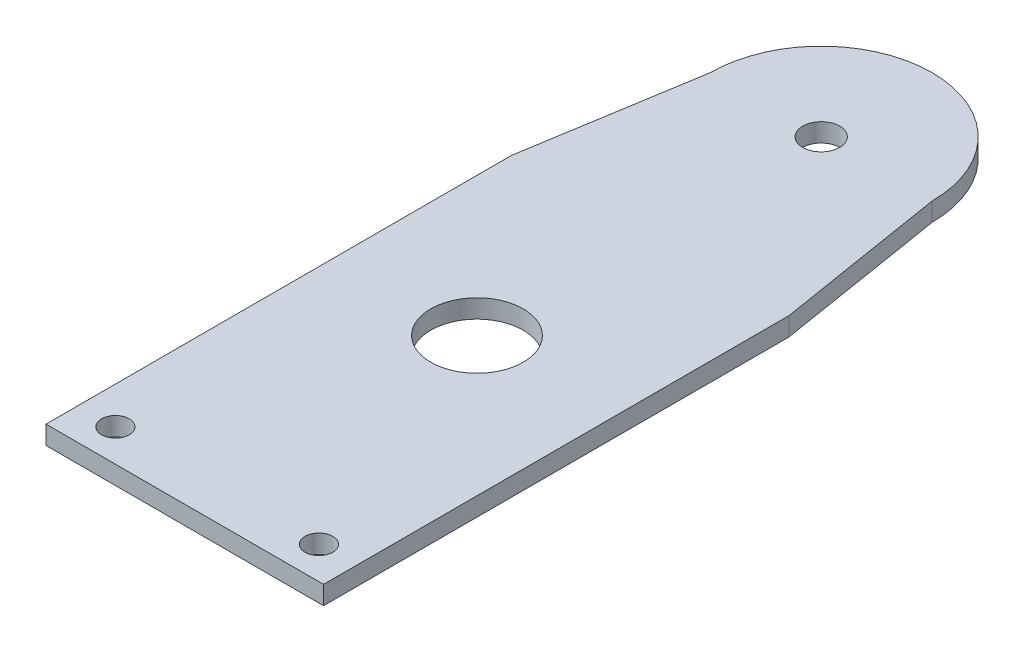
from build123d import *

# Parameters (mm, degrees)
SKETCH_1_R      = 1.5
SKETCH_1_R_2    = 2
SKETCH_1_R_3    = 5
EXTRUDE_1_DEPTH = 2


with BuildPart() as part:
    # Эскиз1 → Бобышка-Вытянуть1 (new body)
    with BuildSketch(Plane(origin=(0, 0, 0), x_dir=(1, 0, 0), z_dir=(0, 1, 0))):
        with BuildLine():
            Line((12.374772085, -29.617278809), (12.374772085, 20.682721191))
            Line((12.374772085, 20.682721191), (9.374772085, 39.182721191))
            ThreePointArc((9.374772085, 39.182721191), (-2.625227915, 51.182721191), (-14.625227915, 39.182721191))
            Line((-14.625227915, 39.182721191), (-17.625227915, 20.682721191))
            Line((-17.625227915, 20.682721191), (-17.625227915, -29.617278809))
            Line((-17.625227915, -29.617278809), (-10.625227915, -29.617278809))
            Line((-10.625227915, -29.617278809), (5.374772085, -29.617278809))
            Line((5.374772085, -29.617278809), (12.374772085, -29.617278809))
        make_face()
        with Locations(Location((-13.625227915, -26.117278809, 0), (0, 0, 270))):
            Circle(SKETCH_1_R, mode=Mode.SUBTRACT)
        with Locations(Location((8.374772085, -26.117278809, 0), (0, 0, 270))):
            Circle(SKETCH_1_R, mode=Mode.SUBTRACT)
        with Locations(Location((-2.625227915, 39.182721191, 0), (0, 0, 270))):
            Circle(SKETCH_1_R_2, mode=Mode.SUBTRACT)
        with Locations(Location((-2.625227915, 1.972721191, 0), (0, 0, 270))):
            Circle(SKETCH_1_R_3, mode=Mode.SUBTRACT)
    extrude(amount=EXTRUDE_1_DEPTH)


solid = part.part
